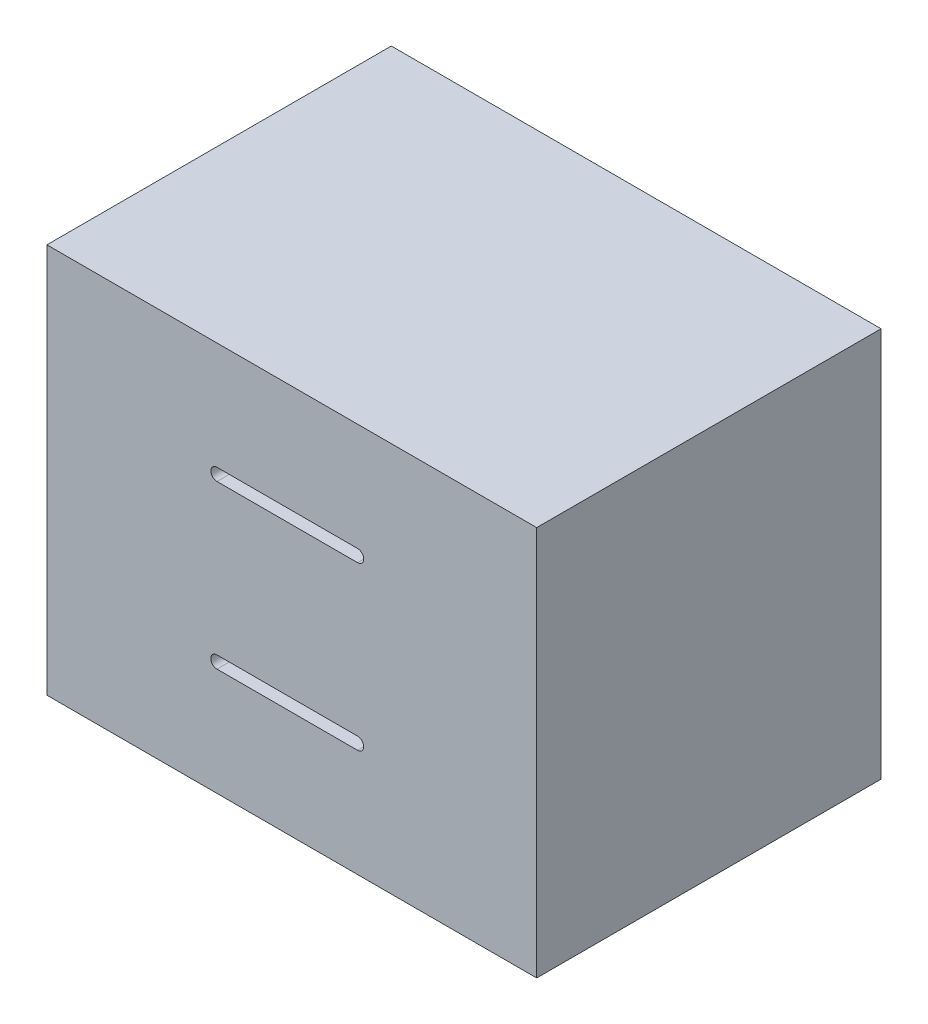
from build123d import *

# Parameters (mm, degrees)
SKETCH1_W           = 53.8
SKETCH1_H           = 37.83
BOSS_EXTRUDE1_DEPTH = 42.85
CUT_EXTRUDE1_DEPTH  = 2


with BuildPart() as part:
    # Sketch1 → Boss-Extrude1 (new body)
    with BuildSketch(Plane(origin=(0, 0, 0), x_dir=(1, 0, 0), z_dir=(0, 1, 0))):
        Rectangle(SKETCH1_W, SKETCH1_H)
    extrude(amount=BOSS_EXTRUDE1_DEPTH)

    # Sketch2 → Cut-Extrude1 (cut)
    with BuildSketch(Plane(origin=(0, 0, -18.915), x_dir=(-1, 0, 0), z_dir=(0, 0, -1))):
        with BuildLine():
            Line((-7.225, 31.025), (8.225, 31.025))
            ThreePointArc((8.225, 31.025), (8.9, 30.35), (8.225, 29.675))
            Line((8.225, 29.675), (-7.225, 29.675))
            ThreePointArc((-7.225, 29.675), (-7.9, 30.35), (-7.225, 31.025))
        make_face()
        with BuildLine():
            Line((-7.225, 13.175), (8.225, 13.175))
            ThreePointArc((8.225, 13.175), (8.9, 12.5), (8.225, 11.825))
            Line((8.225, 11.825), (-7.225, 11.825))
            ThreePointArc((-7.225, 11.825), (-7.9, 12.5), (-7.225, 13.175))
        make_face()
    cut_extrude1 = extrude(amount=-CUT_EXTRUDE1_DEPTH, mode=Mode.SUBTRACT)

    # Mirror1: Cut-Extrude1 across plane
    add(cut_extrude1.mirror(Plane(origin=(0, 0, 0), x_dir=(1, 0, 0), z_dir=(0, 0, -1))), mode=Mode.SUBTRACT)


solid = part.part
